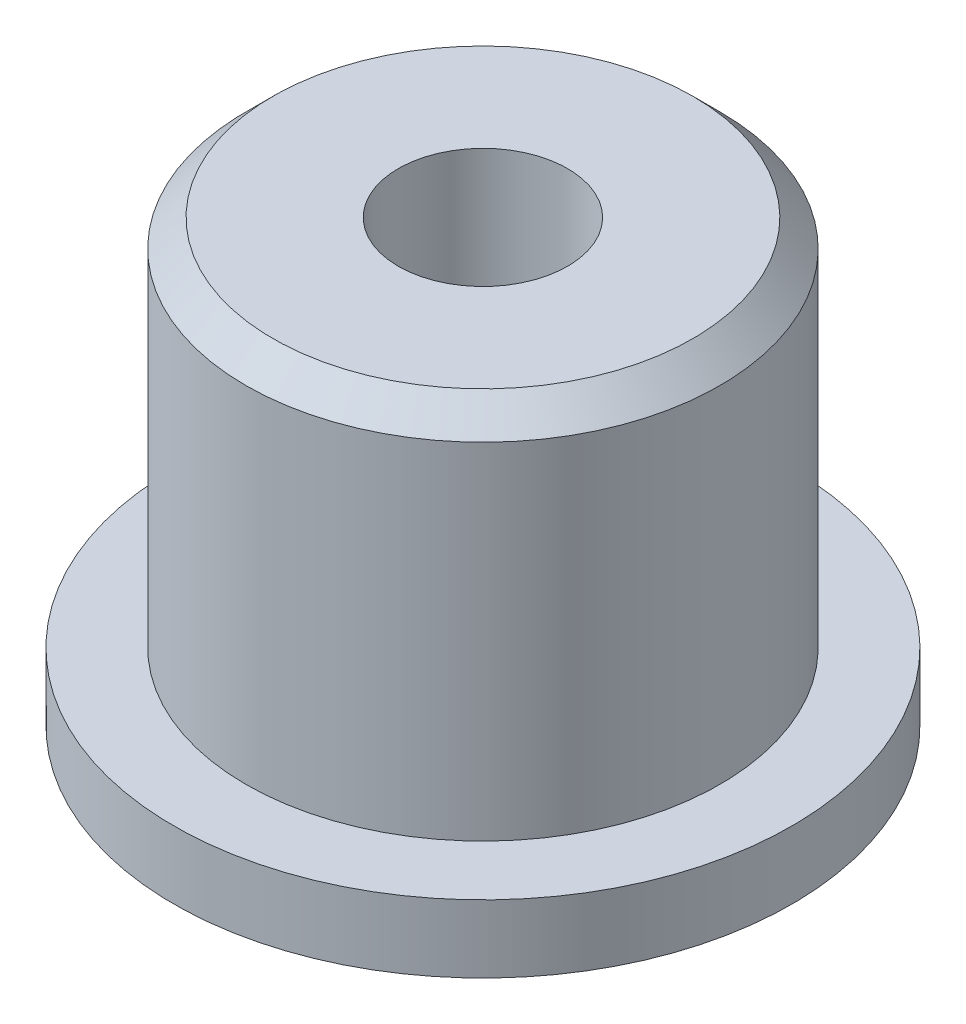
from build123d import *

# Parameters (mm, degrees)
SKETCH1_R           = 18.25
BOSS_EXTRUDE1_DEPTH = 26
CUT_EXTRUDE1_START  = -22
SKETCH2_R           = 18.25
SKETCH2_R_2         = 14
CUT_EXTRUDE1_DEPTH  = 22
SKETCH3_R           = 5
CUT_EXTRUDE2_DEPTH  = 37.635024225


with BuildPart() as part:
    # Sketch1 → Boss-Extrude1 (new body)
    with BuildSketch(Plane(origin=(0, 0, 0), x_dir=(1, 0, 0), z_dir=(0, 1, 0))):
        with Locations(Location((0, 0, 0), (0, 0, 90))):
            Circle(SKETCH1_R)
    extrude(amount=BOSS_EXTRUDE1_DEPTH)

    # Sketch2 → Cut-Extrude1 (cut)
    with BuildSketch(Plane(origin=(0, 26, 0), x_dir=(1, 0, 0), z_dir=(0, 1, 0)).offset(CUT_EXTRUDE1_START)):
        with Locations(Location((0, 0, 0), (0, 0, 90))):
            Circle(SKETCH2_R)
        with Locations(Location((0, 0, 0), (0, 0, 270))):
            Circle(SKETCH2_R_2, mode=Mode.SUBTRACT)
    extrude(amount=CUT_EXTRUDE1_DEPTH, mode=Mode.SUBTRACT)

    # Sketch3 → Cut-Extrude2 (cut, through all)
    with BuildSketch(Plane(origin=(0, 26, 0), x_dir=(1, 0, 0), z_dir=(0, 1, 0))):
        with Locations(Location((0, 0, 0), (0, 0, 270))):
            Circle(SKETCH3_R)
    extrude(amount=-CUT_EXTRUDE2_DEPTH, mode=Mode.SUBTRACT)

    # Sketch4 → Cut-Revolve1 (revolve, cut)
    with BuildSketch(Plane(origin=(0, 0, 0), x_dir=(0, 0, -1), z_dir=(1, 0, 0))):
        Polygon((-14, 24.4), (-14, 26), (-12.4, 26), align=None)
    revolve(axis=Axis((0, -1000, 0), (0, 1, 0)), mode=Mode.SUBTRACT)


solid = part.part
